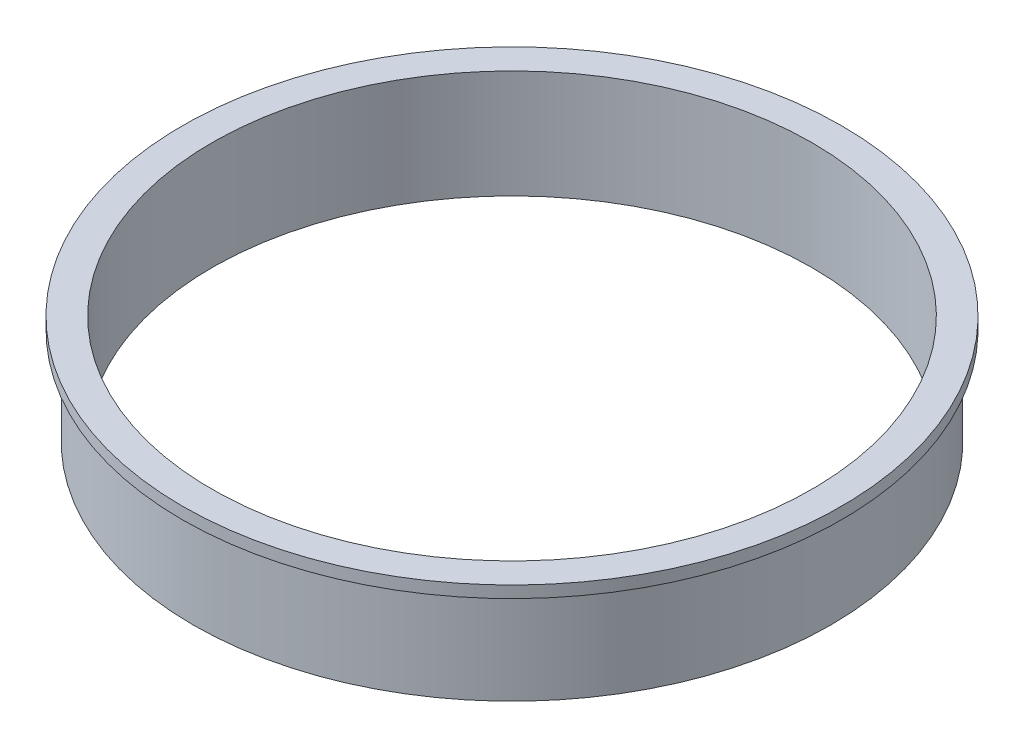
from build123d import *


with BuildPart() as part:
    # Sketch2 → Revolve1 (revolve)
    with BuildSketch(Plane(origin=(0, 0, 0), x_dir=(0, 0, -1), z_dir=(1, 0, 0)), mode=Mode.PRIVATE) as revolve1_sk:
        Polygon((-14.875, 0), (-14, 0), (-14, 5.05), (-15.375, 5.05), (-15.375, 4.5), (-14.875, 4.5), align=None)
    revolve(revolve1_sk.sketch.rotate(Axis((0, 0, 0), (0, 1, 0)), 180), axis=Axis((0, 0, 0), (0, 1, 0)))


solid = part.part
